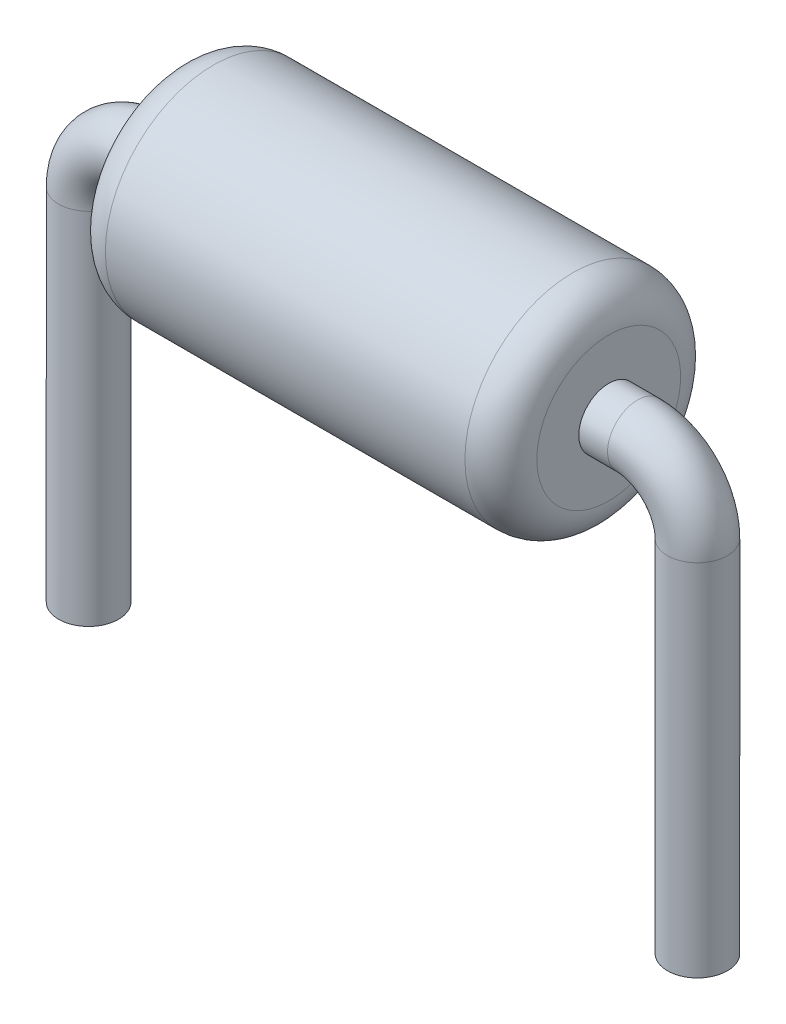
from build123d import *

# Parameters (mm, degrees)
SKETCH1_W            = 1.8
SKETCH1_H            = 0.9
SKETCH3_R            = 0.25
FILLET1_R            = 0.3
FILLET1_OF_MIRROR1_R = 0.3


with BuildPart() as part:
    # Sketch1 → Revolve1 (revolve)
    with BuildSketch(Plane.XY, mode=Mode.PRIVATE) as revolve1_sk:
        with Locations((0.9, 0.45)):
            Rectangle(SKETCH1_W, SKETCH1_H)
    revolve1 = revolve(revolve1_sk.sketch.rotate(Axis((0, 0.9, 0), (1, 0, 0)), 270), axis=Axis((0, 0.9, 0), (1, 0, 0)))

    # Sweep1: sweep along a path in Sketch2
    with BuildLine(Plane.XY) as sweep1_path:
        Line((1.8, 0.9), (2.04, 0.9))
        ThreePointArc((2.04, 0.9), (2.393553391, 0.753553391), (2.54, 0.4))
        Line((2.54, 0.4), (2.54, -2.6))
    # Sketch3 → Sweep1 (sweep)
    with BuildSketch(Plane(origin=(1.8, 0, 0), x_dir=(0, 0, -1), z_dir=(1, 0, 0))):
        with Locations((0, 0.9)):
            Circle(SKETCH3_R)
    sweep1 = sweep(path=sweep1_path.line)

    # Fillet1
    fillet1_edges = [part.edges().sort_by_distance(p)[0] for p in [
        (1.8, 0.9, -0.9),
    ]]
    fillet(fillet1_edges, radius=FILLET1_R)

    # Mirror1: Revolve1, Sweep1 across plane
    add(revolve1.mirror(Plane.ZY))
    add(sweep1.mirror(Plane.ZY))

    # Fillet1 of Mirror1
    fillet1_of_mirror1_edges = [part.edges().sort_by_distance(p)[0] for p in [
        (-1.8, 0.9, -0.9),
    ]]
    fillet(fillet1_of_mirror1_edges, radius=FILLET1_OF_MIRROR1_R)


solid = part.part
